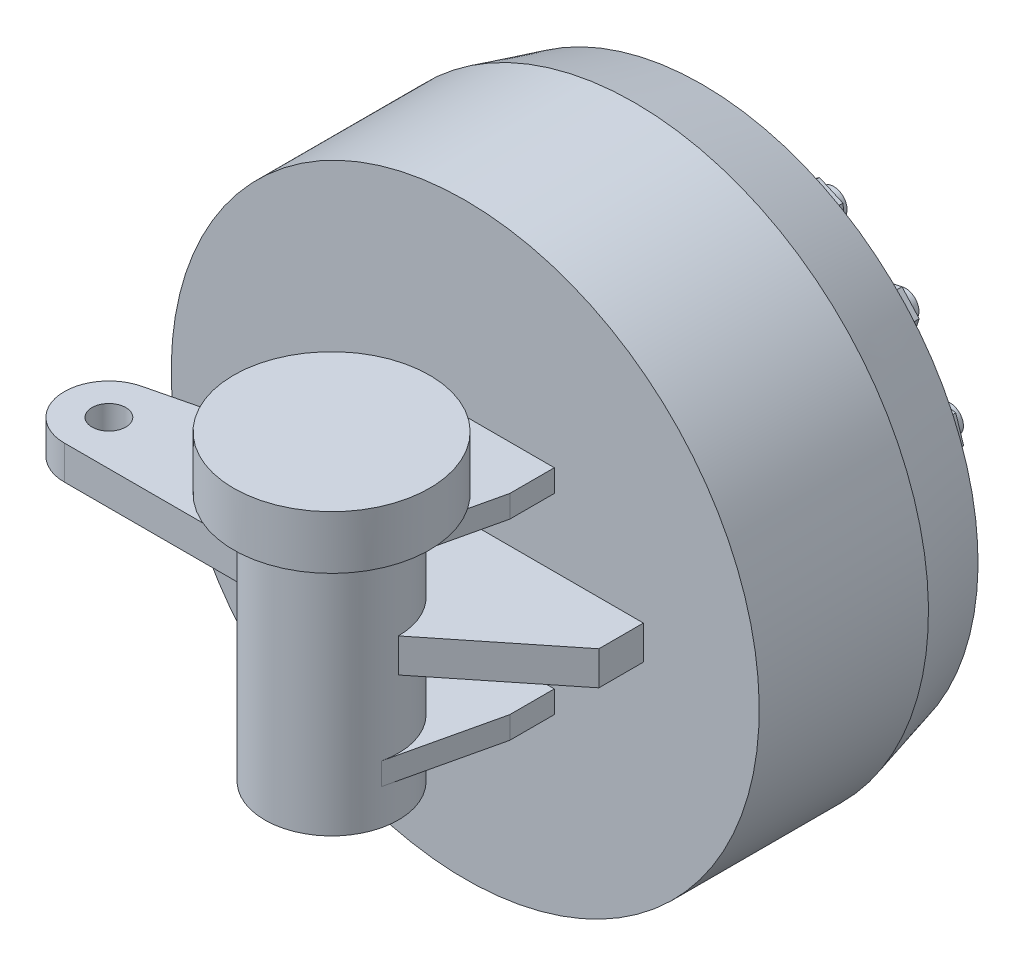
from build123d import *

# Parameters (mm, degrees)
CHAMFER1_SIZE            = 4
FILLET1_R                = 3.5
BOSS_EXTRUDE1_DEPTH      = 90
BOSS_EXTRUDE1_DEPTH_BACK = 80
SKETCH2_R                = 37.5
BOSS_EXTRUDE2_START      = 60
BOSS_EXTRUDE2_DEPTH      = 12.5
SKETCH4_R                = 9.5
BOSS_EXTRUDE3_DEPTH      = 9.5
SKETCH5_R                = 55
BOSS_EXTRUDE4_DEPTH      = 30
SKETCH6_R                = 7.5
BOSS_EXTRUDE5_DEPTH      = 25
BOSS_EXTRUDE6_START      = 6
SKETCH6_3_R              = 7.5
BOSS_EXTRUDE6_DEPTH      = 12.5
CIRPATTERN2_COUNT        = 15


with BuildPart() as part:
    # Sketch1 → Revolve1 (revolve)
    with BuildSketch(Plane(origin=(0, 0, 0), x_dir=(0, 0, -1), z_dir=(1, 0, 0))):
        Polygon((0, 0), (0, 165), (95, 165), (133, 154.817930688), (133, 75), (158, 75), (158, 50), (183, 50), (183, 0), align=None)
    revolve(axis=Axis((0, 0, -183), (0, 0, 1)))

    # Chamfer1
    chamfer1_edges = [part.edges().sort_by_distance(p)[0] for p in [
        (0, -50, -183),
    ]]
    chamfer(chamfer1_edges, length=CHAMFER1_SIZE)

    # Fillet1
    fillet1_edges = [part.edges().sort_by_distance(p)[0] for p in [
        (0, -50, -158),
        (0, -75, -158),
    ]]
    fillet(fillet1_edges, radius=FILLET1_R)



with BuildPart() as body_2:
    # Sketch2 → Boss-Extrude1 (new, two sides: drawn at the far end of the back side and taken through both)
    with BuildSketch(Plane(origin=(0, 0, 0), x_dir=(1, 0, 0), z_dir=(0, 1, 0)).offset(-BOSS_EXTRUDE1_DEPTH_BACK)):
        with Locations(Location((0, -75, 0), (0, 0, 270))):
            Circle(SKETCH2_R)
    extrude(amount=BOSS_EXTRUDE1_DEPTH + BOSS_EXTRUDE1_DEPTH_BACK)


with BuildPart() as part_1:
    add(part.part)

    add(body_2.part)  # Boss-Extrude2 merges body 2
    # Sketch3 → Boss-Extrude2 (add)
    with BuildSketch(Plane(origin=(0, 0, 0), x_dir=(1, 0, 0), z_dir=(0, 1, 0)).offset(BOSS_EXTRUDE2_START)):
        Polygon((-50, 0), (50, 0), (50, -25), (36.542960266, -83.417960266), (-36.542960266, -83.417960266), (-50, -25), align=None)
    boss_extrude2 = extrude(amount=-BOSS_EXTRUDE2_DEPTH)

    # Mirror1: Boss-Extrude2 across plane
    add(boss_extrude2.mirror(Plane.ZX))

    # Sketch4 → Boss-Extrude3 (add, symmetric)
    with BuildSketch(Plane(origin=(0, 0, 0), x_dir=(1, 0, 0), z_dir=(0, 1, 0))):
        with BuildLine():
            Line((-50, 0), (100, 0))
            Line((100, 0), (100, -25))
            Line((100, -25), (37.5, -75))
            ThreePointArc((37.5, -75), (0, -112.5), (-37.5, -75))
            Line((-37.5, -75), (-150, -75))
            ThreePointArc((-150, -75), (-174.822997079, -52.969649142), (-155.897247359, -25.705505282))
            Line((-155.897247359, -25.705505282), (-50, 0))
        make_face()
        with Locations(Location((-150, -50, 0), (0, 0, 270))):
            Circle(SKETCH4_R, mode=Mode.SUBTRACT)
    extrude(amount=BOSS_EXTRUDE3_DEPTH, both=True)

    # Sketch5 → Boss-Extrude4 (add)
    with BuildSketch(Plane(origin=(0, 60, 0), x_dir=(1, 0, 0), z_dir=(0, 1, 0))):
        with Locations(Location((0, -75, 0), (0, 0, 145.958125966))):
            Circle(SKETCH5_R)
    extrude(amount=BOSS_EXTRUDE4_DEPTH)

    # Sketch6 → Boss-Extrude5 (add)
    with BuildSketch(Plane(origin=(0, 0, -133), x_dir=(-1, 0, 0), z_dir=(0, 0, -1))):
        with Locations(Location((0, 120, 0), (0, 0, 90))):
            Circle(SKETCH6_R)
    boss_extrude5 = extrude(amount=BOSS_EXTRUDE5_DEPTH)

    # Sketch6<3> → Boss-Extrude6 (add)
    with BuildSketch(Plane(origin=(0, 0, -133), x_dir=(-1, 0, 0), z_dir=(0, 0, -1)).offset(BOSS_EXTRUDE6_START)):
        Polygon((7.216878365, 132.5), (-7.216878365, 132.5), (-14.43375673, 120), (-7.216878365, 107.5), (7.216878365, 107.5), (14.43375673, 120), align=None)
        with Locations((0, 120)):
            Circle(SKETCH6_3_R, mode=Mode.SUBTRACT)
    boss_extrude6 = extrude(amount=BOSS_EXTRUDE6_DEPTH)

    # CirPattern2: Boss-Extrude5, Boss-Extrude6 ×15 about axis
    cirpattern2_axis = Axis((0, 0, 0), (0, 0, 1))
    add([boss_extrude5.rotate(cirpattern2_axis, i * 360 / CIRPATTERN2_COUNT) for i in range(1, CIRPATTERN2_COUNT)])
    add([boss_extrude6.rotate(cirpattern2_axis, i * 360 / CIRPATTERN2_COUNT) for i in range(1, CIRPATTERN2_COUNT)])


solid = part_1.part
